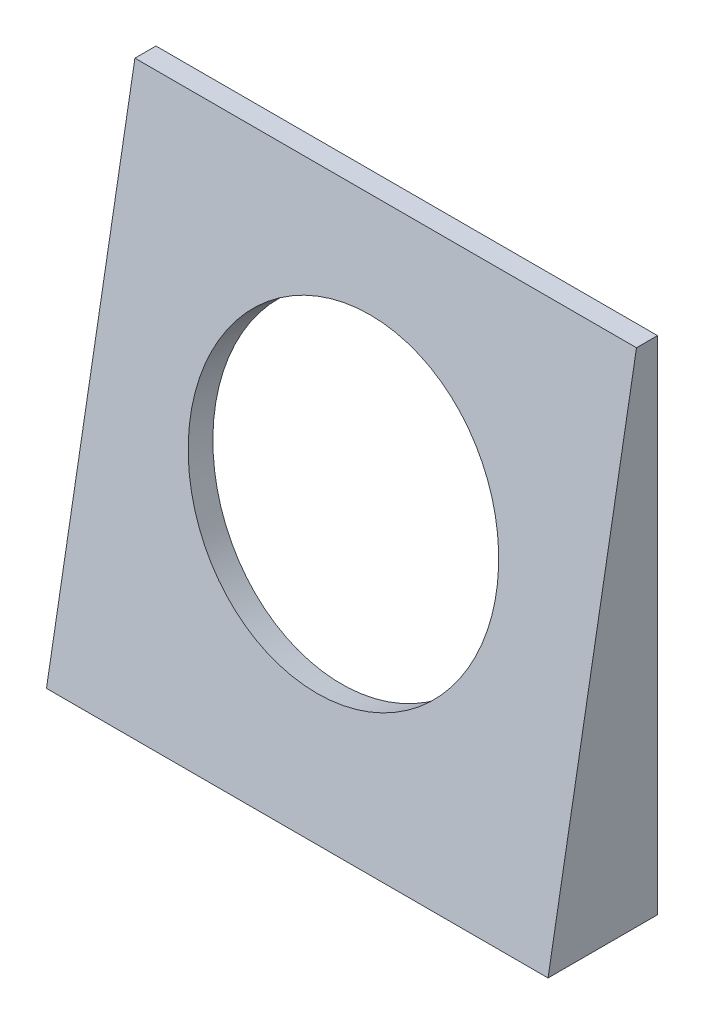
from build123d import *

# Parameters (mm, degrees)
SKETCH1_W               = 20
SKETCH1_H               = 20
SKETCH1_W_2             = 18
SKETCH1_H_2             = 18
BOSS_EXTRUDE1_DEPTH     = 10
BOSS_EXTRUDE3_REACH     = 26.495
CUT_EXTRUDE1_DEPTH      = 25.494897428
CUT_EXTRUDE1_DEPTH_BACK = 25.494897428
SKETCH5_R               = 6.1
CUT_EXTRUDE2_DEPTH      = 10


with BuildPart() as part:
    # Sketch1 → Boss-Extrude1 (new body)
    with BuildSketch(Plane.XY):
        Rectangle(SKETCH1_W, SKETCH1_H)
        Rectangle(SKETCH1_W_2, SKETCH1_H_2, mode=Mode.SUBTRACT)
    extrude(amount=BOSS_EXTRUDE1_DEPTH)

    # Sketch3 → Boss-Extrude3 (add, up to next)
    with BuildSketch(Plane(origin=(10, 0, 0), x_dir=(0, 0, -1), z_dir=(1, 0, 0)), mode=Mode.PRIVATE) as boss_extrude3_sk1:
        Polygon((0, 9), (-3.350212633, -10), (-4.365639245, -10), (-1.015426612, 9), align=None)
    boss_extrude3_tool1 = extrude(boss_extrude3_sk1.sketch, amount=-BOSS_EXTRUDE3_REACH, mode=Mode.PRIVATE) - part.part
    add(boss_extrude3_tool1.solids().sort_by_distance((10, -0.5, 2.18282))[0])

    # Sketch4 → Cut-Extrude1 (cut, two sides: drawn at the far end of the back side and taken through both)
    with BuildSketch(Plane.ZY.offset(10).offset(-CUT_EXTRUDE1_DEPTH_BACK)):
        Polygon((-8.537287031, 63.176131209), (0.839099631, 10), (4.365639245, -10), (13.742025907, -63.176131209), (120.094288326, -44.423357885), (97.814975388, 81.928904533), align=None)
    extrude(amount=CUT_EXTRUDE1_DEPTH + CUT_EXTRUDE1_DEPTH_BACK, mode=Mode.SUBTRACT)

    # Sketch5 → Cut-Extrude2 (cut)
    with BuildSketch(Plane(origin=(0, 0.271383206, 1.539090645), x_dir=(-1, 0, 0), z_dir=(0, -0.17364817766692345, -0.9848077530122092))):
        with Locations(Location((0, 0, 0), (0, 0, 90))):
            Circle(SKETCH5_R)
    extrude(amount=-CUT_EXTRUDE2_DEPTH, mode=Mode.SUBTRACT)


solid = part.part
